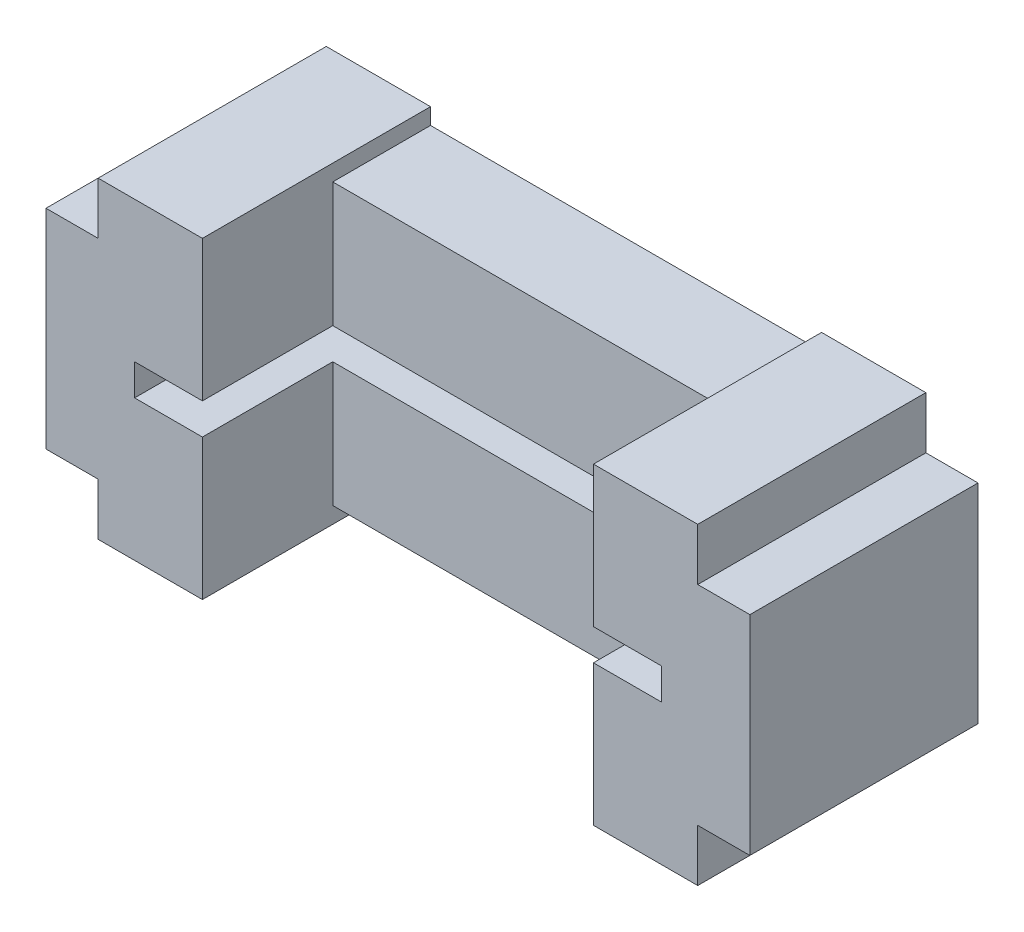
from build123d import *

# Parameters (mm, degrees)
BOSS_EXTRUDE1_DEPTH     = 9.525
BOSS_EXTRUDE2_DEPTH     = 12.7
SKETCH4_W               = 51.308
SKETCH4_H               = 3.048
CUT_EXTRUDE1_DEPTH      = 6.096
CUT_EXTRUDE2_DEPTH      = 40.61504386
CUT_EXTRUDE2_DEPTH_BACK = 40.61504386
SKETCH5_W               = 38.1
SKETCH5_H               = 1.5875


with BuildPart() as part:
    # Sketch1 → Boss-Extrude1 (new body)
    with BuildSketch(Plane.XY):
        Polygon((-29.21, -15.24), (29.21, -15.24), (29.21, -10.16), (34.29, -10.16), (34.29, 10.16), (29.21, 10.16), (29.21, 15.24), (-29.21, 15.24), (-29.21, 10.16), (-34.29, 10.16), (-34.29, -10.16), (-29.21, -10.16), align=None)
    extrude(amount=BOSS_EXTRUDE1_DEPTH)

    # Sketch3 → Boss-Extrude2 (add)
    with BuildSketch(Plane.XY.offset(9.525)):
        Polygon((-29.21, 15.24), (-19.05, 15.24), (-19.05, 1.524), (-25.654, 1.524), (-25.654, -1.524), (-19.05, -1.524), (-19.05, -15.24), (-29.21, -15.24), (-29.21, -10.16), (-34.29, -10.16), (-34.29, 10.16), (-29.21, 10.16), align=None)
        Polygon((19.05, -1.524), (19.05, -15.24), (29.21, -15.24), (29.21, -10.16), (34.29, -10.16), (34.29, 10.16), (29.21, 10.16), (29.21, 15.24), (19.05, 15.24), (19.05, 1.524), (25.654, 1.524), (25.654, -1.524), align=None)
    extrude(amount=BOSS_EXTRUDE2_DEPTH)

    # Sketch4 → Cut-Extrude1 (cut)
    with BuildSketch(Plane.XY.offset(9.525)):
        Rectangle(SKETCH4_W, SKETCH4_H)
    extrude(amount=-CUT_EXTRUDE1_DEPTH, mode=Mode.SUBTRACT)

    # Sketch5 → Cut-Extrude2 (cut, two sides: drawn at the far end of the back side and taken through both)
    with BuildSketch(Plane.XY.offset(9.525).offset(-CUT_EXTRUDE2_DEPTH_BACK)):
        with Locations((0, 14.44625)):
            Rectangle(SKETCH5_W, SKETCH5_H)
        with Locations((0, -14.44625)):
            Rectangle(SKETCH5_W, SKETCH5_H)
    extrude(amount=CUT_EXTRUDE2_DEPTH + CUT_EXTRUDE2_DEPTH_BACK, mode=Mode.SUBTRACT)


solid = part.part
